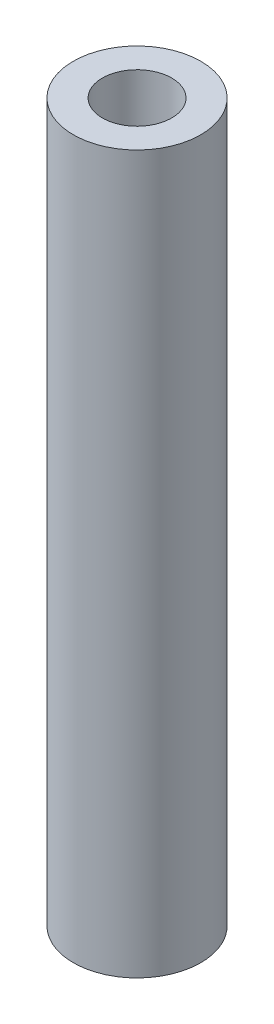
from build123d import *

# Parameters (mm, degrees)
CROQUIS1_R              = 4
CROQUIS1_R_2            = 2.175
SALIENTE_EXTRUIR1_DEPTH = 45


with BuildPart() as part:
    # Croquis1 → Saliente-Extruir1 (new body)
    with BuildSketch(Plane(origin=(0, 0, 0), x_dir=(1, 0, 0), z_dir=(0, 1, 0))):
        with Locations(Location((0, 0, 0), (0, 0, 90))):
            Circle(CROQUIS1_R)
        with Locations(Location((0, 0, 0), (0, 0, 90))):
            Circle(CROQUIS1_R_2, mode=Mode.SUBTRACT)
    extrude(amount=SALIENTE_EXTRUIR1_DEPTH)


solid = part.part
